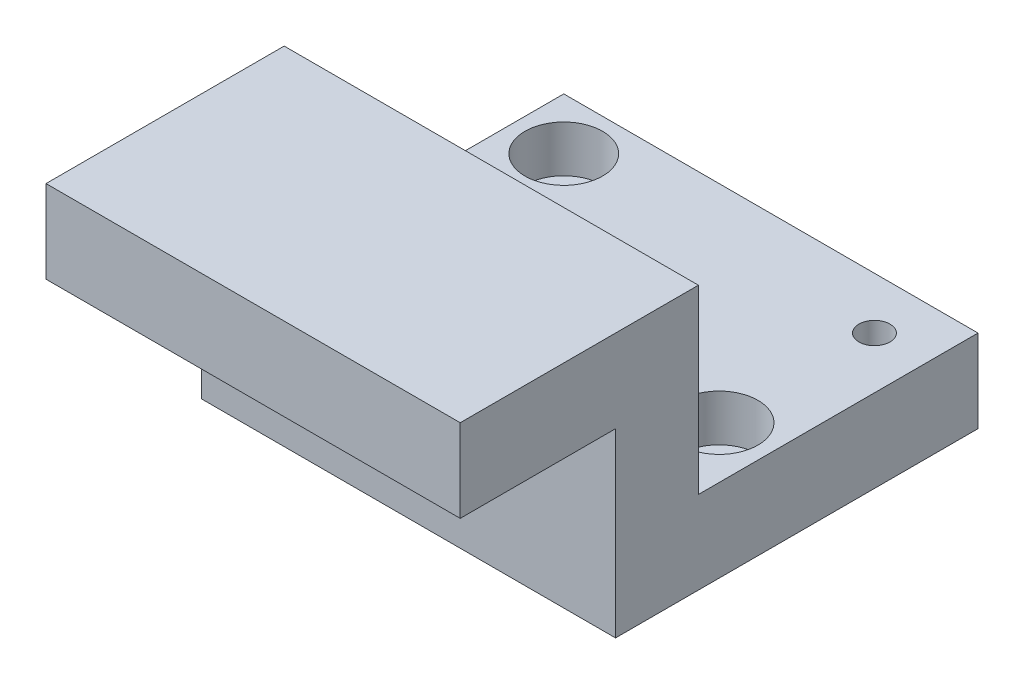
from build123d import *

# Parameters (mm, degrees)
SKETCH_1_W                = 80
SKETCH_1_H                = 51
EXTRUDE_1_DEPTH           = 100
SKETCH_2_W                = 30
SKETCH_2_H                = 35
CUT_EXTRUDE_1_DEPTH       = 131.576605868
SKETCH_3_W                = 54
SKETCH_3_H                = 35
CUT_EXTRUDE_2_DEPTH       = 131.576605868
HOLE_WIZARD_1_D           = 9
HOLE_WIZARD_1_CBORE_D     = 15
HOLE_WIZARD_1_CBORE_DEPTH = 9
MM_1_D                    = 6


with BuildPart() as part:
    # 草图1 → 凸台-拉伸1 (new body)
    with BuildSketch(Plane.XY):
        Rectangle(SKETCH_1_W, SKETCH_1_H)
    extrude(amount=EXTRUDE_1_DEPTH)

    # 草图2 → 切除-拉伸1 (cut, through all)
    with BuildSketch(Plane(origin=(40, 0, 0), x_dir=(0, 0, -1), z_dir=(1, 0, 0))):
        with Locations((-85, -8)):
            Rectangle(SKETCH_2_W, SKETCH_2_H)
    extrude(amount=-CUT_EXTRUDE_1_DEPTH, mode=Mode.SUBTRACT)

    # 草图3 → 切除-拉伸2 (cut, through all)
    with BuildSketch(Plane(origin=(40, 0, 0), x_dir=(0, 0, -1), z_dir=(1, 0, 0))):
        with Locations((-27, 8)):
            Rectangle(SKETCH_3_W, SKETCH_3_H)
    extrude(amount=-CUT_EXTRUDE_2_DEPTH, mode=Mode.SUBTRACT)

    # 打孔尺寸(%根据)内六角圆柱头螺钉的类型1 (through all)
    with Locations(Plane(origin=(0, -9.5, 0), x_dir=(1, 0, 0), z_dir=(0, 1, 0))):
        with Locations((-30, -10), (30, -40)):
            CounterBoreHole(HOLE_WIZARD_1_D / 2, HOLE_WIZARD_1_CBORE_D / 2, HOLE_WIZARD_1_CBORE_DEPTH)

    # 大小mm 暗销孔1 (through all)
    with Locations(Plane(origin=(0, -9.5, 0), x_dir=(1, 0, 0), z_dir=(0, 1, 0))):
        with Locations((-30, -40), (30, -10)):
            Hole(MM_1_D / 2)


solid = part.part
